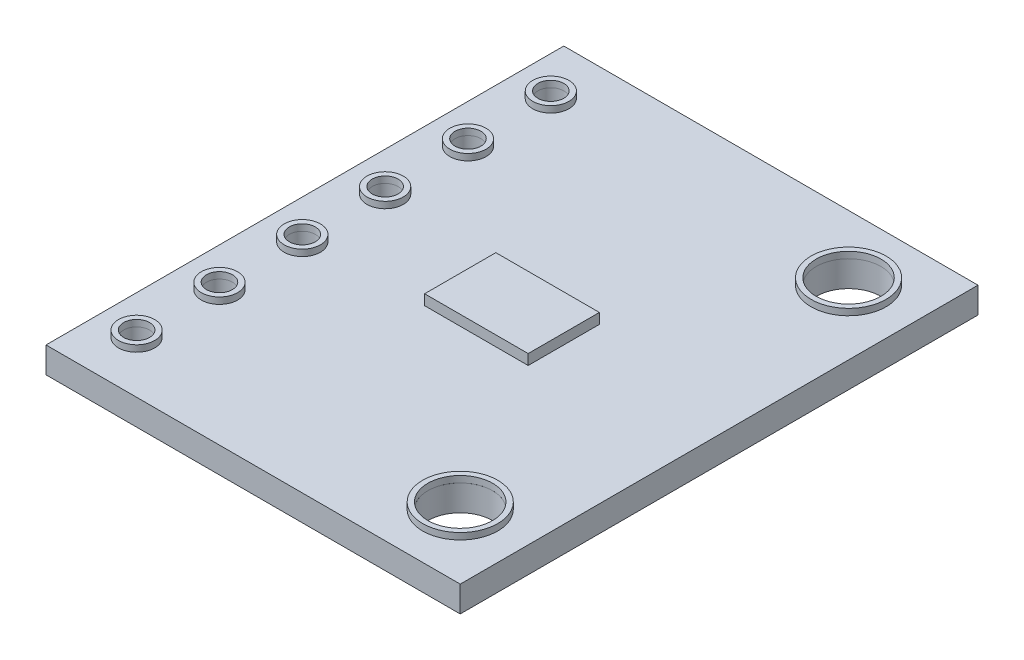
from build123d import *

# Parameters (mm, degrees)
SKETCH1_W             = 16
SKETCH1_H             = 20
BOSS_EXTRUDE1_DEPTH   = 1
SKETCH2_R             = 0.5
SKETCH2_R_2           = 1.25
CUT_EXTRUDE1_DEPTH    = 1
SKETCH3_R             = 1.45
SKETCH3_R_2           = 1.25
BOSS_EXTRUDE2_DEPTH   = 0.25
BOSS_EXTRUDE2_2_DEPTH = 0.25
SKETCH3_R_3           = 0.7
SKETCH3_R_4           = 0.5
BOSS_EXTRUDE2_3_DEPTH = 0.25
BOSS_EXTRUDE2_4_DEPTH = 0.25
BOSS_EXTRUDE2_5_DEPTH = 0.25
BOSS_EXTRUDE2_6_DEPTH = 0.25
BOSS_EXTRUDE2_7_DEPTH = 0.25
BOSS_EXTRUDE2_8_DEPTH = 0.25
SKETCH4_W             = 4
SKETCH4_H             = 2.75
BOSS_EXTRUDE3_DEPTH   = 0.4


with BuildPart() as part:
    # Sketch1 → Boss-Extrude1 (new body)
    with BuildSketch(Plane(origin=(0, 0, 0), x_dir=(1, 0, 0), z_dir=(0, 1, 0))):
        Rectangle(SKETCH1_W, SKETCH1_H)
    extrude(amount=BOSS_EXTRUDE1_DEPTH)

    # Sketch2 → Cut-Extrude1 (cut)
    with BuildSketch(Plane(origin=(0, 1, 0), x_dir=(1, 0, 0), z_dir=(0, 1, 0))):
        with Locations(Location((-6.5, 8, 0), (0, 0, 270))):
            Circle(SKETCH2_R)
        with Locations(Location((-6.5, 4.8, 0), (0, 0, 270))):
            Circle(SKETCH2_R)
        with Locations(Location((-6.5, 1.6, 0), (0, 0, 270))):
            Circle(SKETCH2_R)
        with Locations(Location((-6.5, -1.6, 0), (0, 0, 270))):
            Circle(SKETCH2_R)
        with Locations(Location((-6.5, -4.8, 0), (0, 0, 270))):
            Circle(SKETCH2_R)
        with Locations(Location((-6.5, -8, 0), (0, 0, 270))):
            Circle(SKETCH2_R)
        with Locations(Location((5.5, 7.5, 0), (0, 0, 270))):
            Circle(SKETCH2_R_2)
        with Locations(Location((5.5, -7.5, 0), (0, 0, 90))):
            Circle(SKETCH2_R_2)
    extrude(amount=-CUT_EXTRUDE1_DEPTH, mode=Mode.SUBTRACT)


with BuildPart() as body_2:
    # Sketch3 → Boss-Extrude2 (new body)
    with BuildSketch(Plane(origin=(0, 1, 0), x_dir=(1, 0, 0), z_dir=(0, 1, 0))):
        with Locations(Location((5.5, -7.5, 0), (0, 0, 270))):
            Circle(SKETCH3_R)
        with Locations(Location((5.5, -7.5, 0), (0, 0, 270))):
            Circle(SKETCH3_R_2, mode=Mode.SUBTRACT)
    extrude(amount=BOSS_EXTRUDE2_DEPTH)


with BuildPart() as body_3:
    # Sketch3 → Boss-Extrude2 2 (new body)
    with BuildSketch(Plane(origin=(0, 1, 0), x_dir=(1, 0, 0), z_dir=(0, 1, 0))):
        with Locations(Location((5.5, 7.5, 0), (0, 0, 270))):
            Circle(SKETCH3_R)
        with Locations(Location((5.5, 7.5, 0), (0, 0, 270))):
            Circle(SKETCH3_R_2, mode=Mode.SUBTRACT)
    extrude(amount=BOSS_EXTRUDE2_2_DEPTH)


with BuildPart() as body_4:
    # Sketch3 → Boss-Extrude2 3 (new body)
    with BuildSketch(Plane(origin=(0, 1, 0), x_dir=(1, 0, 0), z_dir=(0, 1, 0))):
        with Locations(Location((-6.5, -8, 0), (0, 0, 270))):
            Circle(SKETCH3_R_3)
        with Locations(Location((-6.5, -8, 0), (0, 0, 270))):
            Circle(SKETCH3_R_4, mode=Mode.SUBTRACT)
    extrude(amount=BOSS_EXTRUDE2_3_DEPTH)


with BuildPart() as body_5:
    # Sketch3 → Boss-Extrude2 4 (new body)
    with BuildSketch(Plane(origin=(0, 1, 0), x_dir=(1, 0, 0), z_dir=(0, 1, 0))):
        with Locations(Location((-6.5, -4.8, 0), (0, 0, 270))):
            Circle(SKETCH3_R_3)
        with Locations(Location((-6.5, -4.8, 0), (0, 0, 270))):
            Circle(SKETCH3_R_4, mode=Mode.SUBTRACT)
    extrude(amount=BOSS_EXTRUDE2_4_DEPTH)


with BuildPart() as body_6:
    # Sketch3 → Boss-Extrude2 5 (new body)
    with BuildSketch(Plane(origin=(0, 1, 0), x_dir=(1, 0, 0), z_dir=(0, 1, 0))):
        with Locations(Location((-6.5, -1.6, 0), (0, 0, 270))):
            Circle(SKETCH3_R_3)
        with Locations(Location((-6.5, -1.6, 0), (0, 0, 270))):
            Circle(SKETCH3_R_4, mode=Mode.SUBTRACT)
    extrude(amount=BOSS_EXTRUDE2_5_DEPTH)


with BuildPart() as body_7:
    # Sketch3 → Boss-Extrude2 6 (new body)
    with BuildSketch(Plane(origin=(0, 1, 0), x_dir=(1, 0, 0), z_dir=(0, 1, 0))):
        with Locations(Location((-6.5, 1.6, 0), (0, 0, 270))):
            Circle(SKETCH3_R_3)
        with Locations(Location((-6.5, 1.6, 0), (0, 0, 270))):
            Circle(SKETCH3_R_4, mode=Mode.SUBTRACT)
    extrude(amount=BOSS_EXTRUDE2_6_DEPTH)


with BuildPart() as body_8:
    # Sketch3 → Boss-Extrude2 7 (new body)
    with BuildSketch(Plane(origin=(0, 1, 0), x_dir=(1, 0, 0), z_dir=(0, 1, 0))):
        with Locations(Location((-6.5, 4.8, 0), (0, 0, 270))):
            Circle(SKETCH3_R_3)
        with Locations(Location((-6.5, 4.8, 0), (0, 0, 270))):
            Circle(SKETCH3_R_4, mode=Mode.SUBTRACT)
    extrude(amount=BOSS_EXTRUDE2_7_DEPTH)


with BuildPart() as body_9:
    # Sketch3 → Boss-Extrude2 8 (new body)
    with BuildSketch(Plane(origin=(0, 1, 0), x_dir=(1, 0, 0), z_dir=(0, 1, 0))):
        with Locations(Location((-6.5, 8, 0), (0, 0, 270))):
            Circle(SKETCH3_R_3)
        with Locations(Location((-6.5, 8, 0), (0, 0, 270))):
            Circle(SKETCH3_R_4, mode=Mode.SUBTRACT)
    extrude(amount=BOSS_EXTRUDE2_8_DEPTH)


with BuildPart() as body_10:
    # Sketch4 → Boss-Extrude3 (new body)
    with BuildSketch(Plane(origin=(0, 1, 0), x_dir=(1, 0, 0), z_dir=(0, 1, 0))):
        Rectangle(SKETCH4_W, SKETCH4_H)
    extrude(amount=BOSS_EXTRUDE3_DEPTH)


solid = Compound([part.part, body_2.part, body_3.part, body_4.part, body_5.part, body_6.part, body_7.part, body_8.part, body_9.part, body_10.part])
